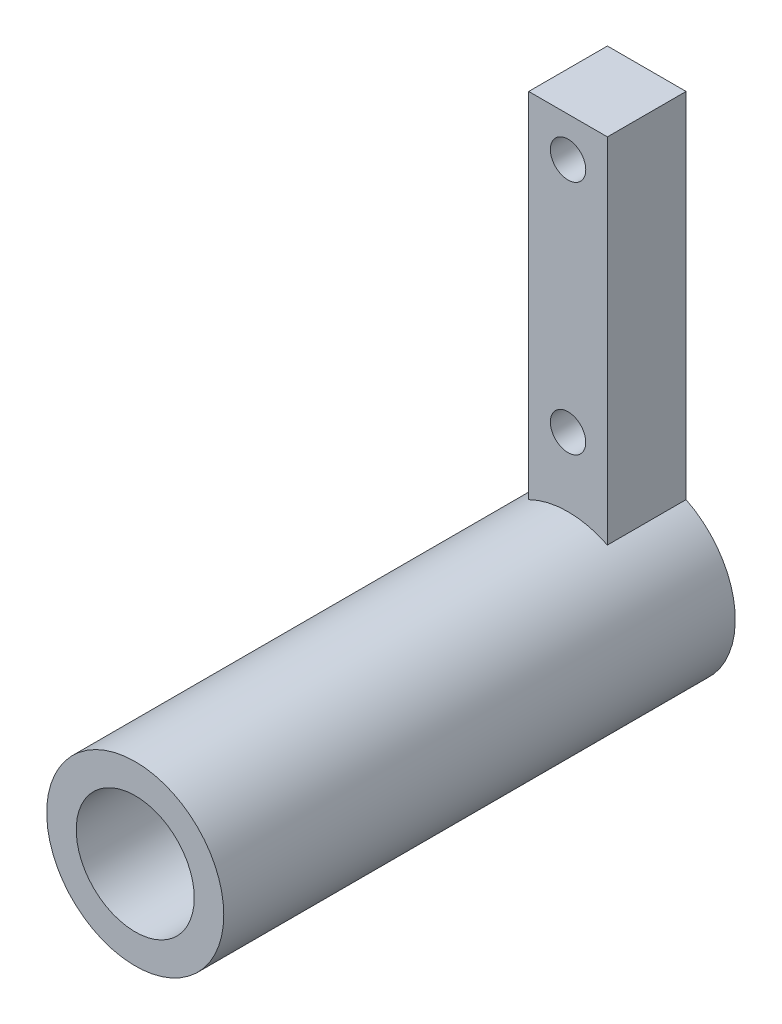
from build123d import *

# Parameters (mm, degrees)
ESQUISSE1_R             = 22.5
BASE_EXTRUSION_DEPTH    = 130
ESQUISSE2_W             = 20
ESQUISSE2_H             = 20
BOSS_EXTRU_1_DEPTH      = 110
ESQUISSE3_R             = 4.5
ENL_V_MAT_EXTRU_1_DEPTH = 20
ESQUISSE4_R             = 15
ENL_V_MAT_EXTRU_2_DEPTH = 120


with BuildPart() as part:
    # Esquisse1 → Base-Extrusion (new body)
    with BuildSketch(Plane.XY):
        with Locations(Location((0, 0, 0), (0, 0, 116.387799961))):
            Circle(ESQUISSE1_R)
    extrude(amount=BASE_EXTRUSION_DEPTH)

    # Esquisse2 → Boss.-Extru.1 (add)
    with BuildSketch(Plane(origin=(0, 0, 0), x_dir=(1, 0, 0), z_dir=(0, 1, 0))):
        with Locations((0, -10)):
            Rectangle(ESQUISSE2_W, ESQUISSE2_H)
    extrude(amount=BOSS_EXTRU_1_DEPTH)

    # Esquisse3 → Enlèv. mat.-Extru.1 (cut)
    with BuildSketch(Plane.XY.offset(20)):
        with Locations((0, 100)):
            Circle(ESQUISSE3_R)
        with Locations((0, 40)):
            Circle(ESQUISSE3_R)
    extrude(amount=-ENL_V_MAT_EXTRU_1_DEPTH, mode=Mode.SUBTRACT)

    # Esquisse4 → Enlèv. mat.-Extru.2 (cut)
    with BuildSketch(Plane.XY.offset(130)):
        Circle(ESQUISSE4_R)
    extrude(amount=-ENL_V_MAT_EXTRU_2_DEPTH, mode=Mode.SUBTRACT)


solid = part.part
